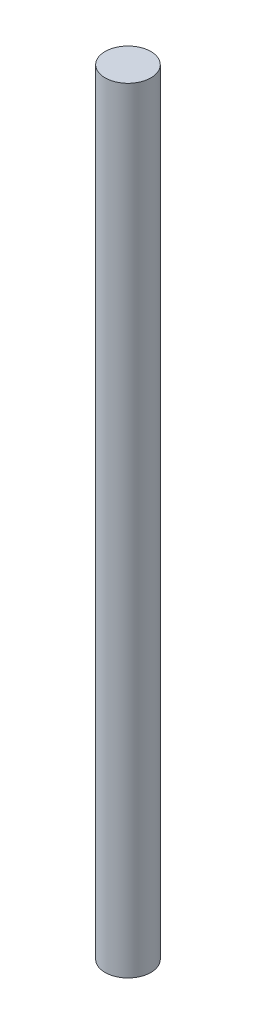
from build123d import *

# Parameters (mm, degrees)
SKETCH1_R           = 10
BOSS_EXTRUDE1_DEPTH = 339


with BuildPart() as part:
    # Sketch1 → Boss-Extrude1 (new body)
    with BuildSketch(Plane(origin=(0, 0, 0), x_dir=(1, 0, 0), z_dir=(0, 1, 0))):
        with Locations(Location((0, 0, 0), (0, 0, 270))):
            Circle(SKETCH1_R)
    extrude(amount=BOSS_EXTRUDE1_DEPTH)


solid = part.part
